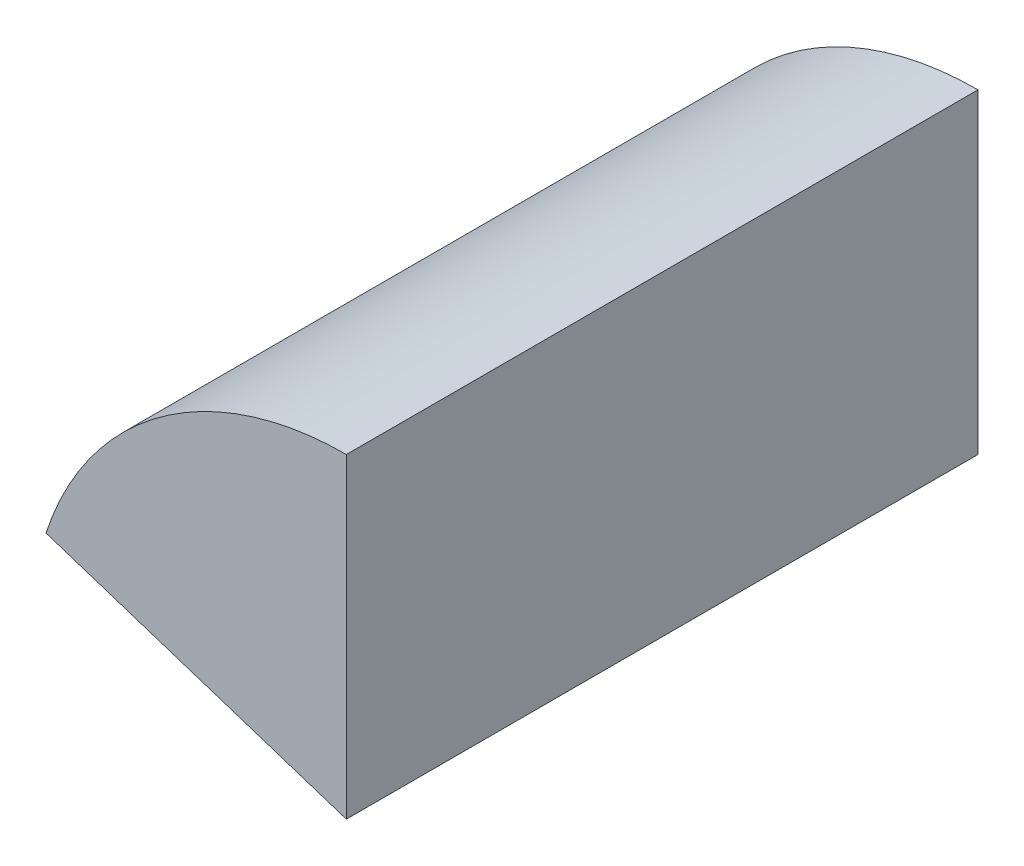
from build123d import *

# Parameters (mm, degrees)
SALIENTE_EXTRUIR1_DEPTH = 50
CROQUIS2_R              = 5
CORTAR_EXTRUIR1_DEPTH   = 10


with BuildPart() as part:
    # Croquis1 → Saliente-Extruir1 (new body)
    with BuildSketch(Plane.XY):
        with BuildLine():
            Line((0, 25), (0, 0))
            Line((0, 0), (-23.776412907, 7.725424859))
            ThreePointArc((-23.776412907, 7.725424859), (-14.694631307, 20.225424859), (0, 25))
        make_face()
    extrude(amount=SALIENTE_EXTRUIR1_DEPTH)

    # Croquis2 → Cortar-Extruir1 (cut)
    with BuildSketch(Plane(origin=(0, 0, 0), x_dir=(-1, 0, 0), z_dir=(0, 0, -1))):
        with Locations((9.035159756, 12.480979689)):
            Circle(CROQUIS2_R)
    extrude(amount=-CORTAR_EXTRUIR1_DEPTH, mode=Mode.SUBTRACT)


solid = part.part
